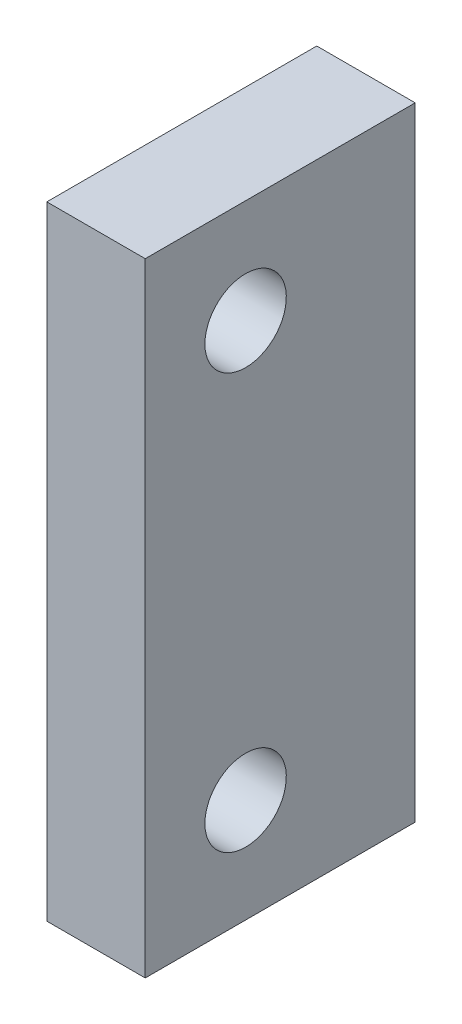
from build123d import *

# Parameters (mm, degrees)
SKETCH2_W                  = 16.51
SKETCH2_H                  = 38.1
BOSS_EXTRUDE1_DEPTH        = 6.0198
F_10_CLEARANCE_HOLE1_D     = 4.9784
F_10_CLEARANCE_HOLE1_DEPTH = 25.4
F_10_CLEARANCE_HOLE1_TIP   = 1.495662253


with BuildPart() as part:
    # Sketch2 → Boss-Extrude1 (new body)
    with BuildSketch(Plane(origin=(-488.965433296, 0, 0), x_dir=(0, 0, -1), z_dir=(1, 0, 0))):
        with Locations((186.732330939, 147.533779805)):
            Rectangle(SKETCH2_W, SKETCH2_H)
    extrude(amount=BOSS_EXTRUDE1_DEPTH)

    # #10 Clearance Hole1
    with Locations(Plane.ZY.offset(488.965433296)):
        with Locations((-184.616110941, 160.233779805), (-184.616110941, 134.833779805)):
            Hole(F_10_CLEARANCE_HOLE1_D / 2, depth=F_10_CLEARANCE_HOLE1_DEPTH)
            with Locations((0, 0, -(F_10_CLEARANCE_HOLE1_DEPTH + F_10_CLEARANCE_HOLE1_TIP / 2))):  # 118° drill point
                Cone(0, F_10_CLEARANCE_HOLE1_D / 2, F_10_CLEARANCE_HOLE1_TIP, mode=Mode.SUBTRACT)


solid = part.part
